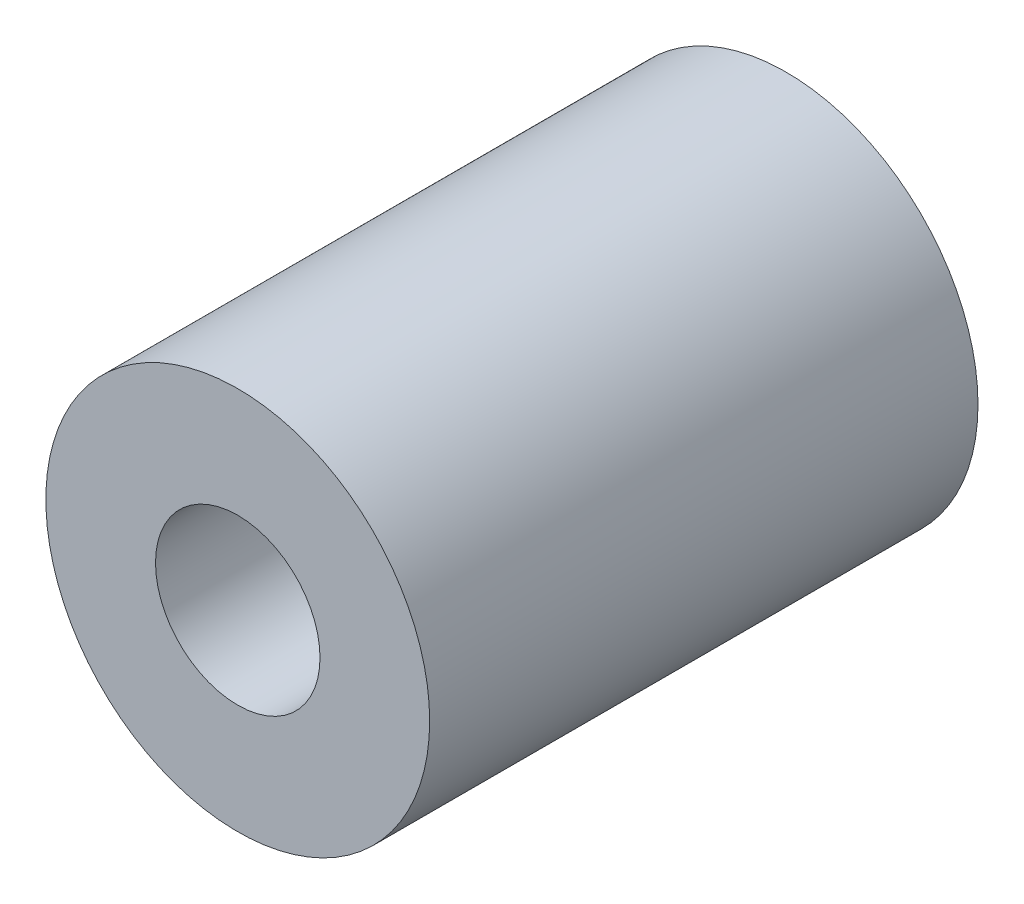
from build123d import *

# Parameters (mm, degrees)
SKETCH_1_R      = 3.5
SKETCH_1_R_2    = 1.5
EXTRUDE_1_DEPTH = 5


with BuildPart() as part:
    # 草圖1 → 填料-伸長1 (new, symmetric)
    with BuildSketch(Plane.XY):
        Circle(SKETCH_1_R)
        Circle(SKETCH_1_R_2, mode=Mode.SUBTRACT)
    extrude(amount=EXTRUDE_1_DEPTH, both=True)


solid = part.part
